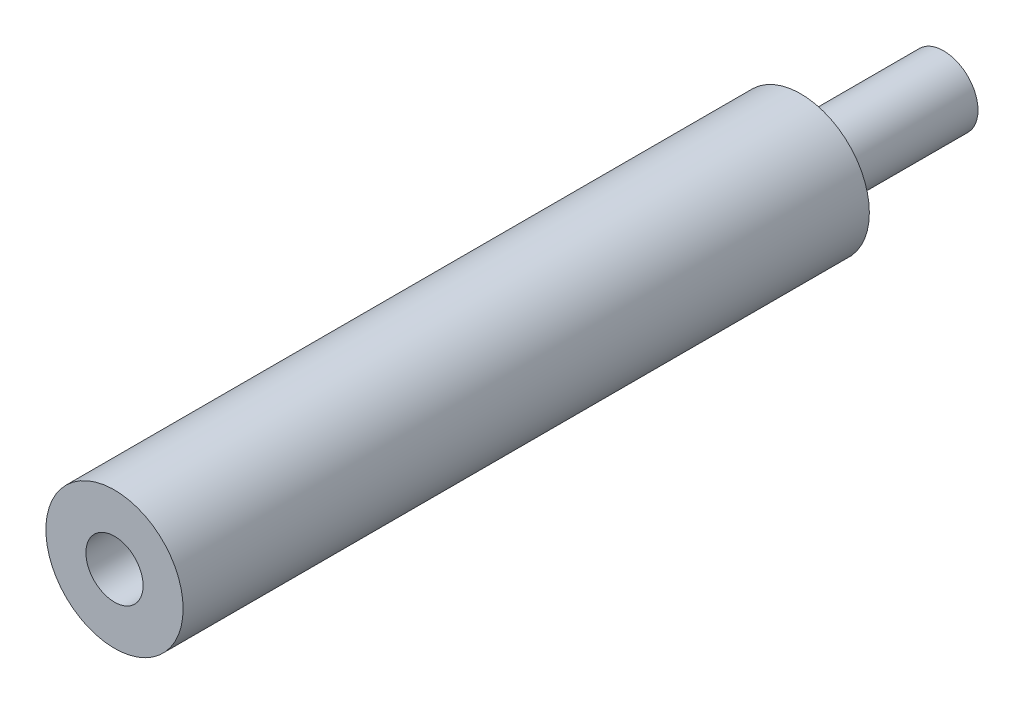
from build123d import *

# Parameters (mm, degrees)
SKETCH_1_R          = 6
EXTRUDE_1_DEPTH     = 30
SKETCH_2_R          = 3
EXTRUDE_2_DEPTH     = 12.5
SKETCH_4_R          = 2.5
CUT_EXTRUDE_1_DEPTH = 10


with BuildPart() as part:
    # 草图1 → 凸台-拉伸1 (new, symmetric)
    with BuildSketch(Plane.XY):
        Circle(SKETCH_1_R)
    extrude(amount=EXTRUDE_1_DEPTH, both=True)

    # 草图2 → 凸台-拉伸2 (add)
    with BuildSketch(Plane(origin=(0, 0, -30), x_dir=(-1, 0, 0), z_dir=(0, 0, -1))):
        with Locations(Location((0, 0, 0), (0, 0, 180))):
            Circle(SKETCH_2_R)
    extrude(amount=EXTRUDE_2_DEPTH)

    # 草图4 → 切除-拉伸1 (cut)
    with BuildSketch(Plane.XY.offset(30)):
        Circle(SKETCH_4_R)
    extrude(amount=-CUT_EXTRUDE_1_DEPTH, mode=Mode.SUBTRACT)


solid = part.part
